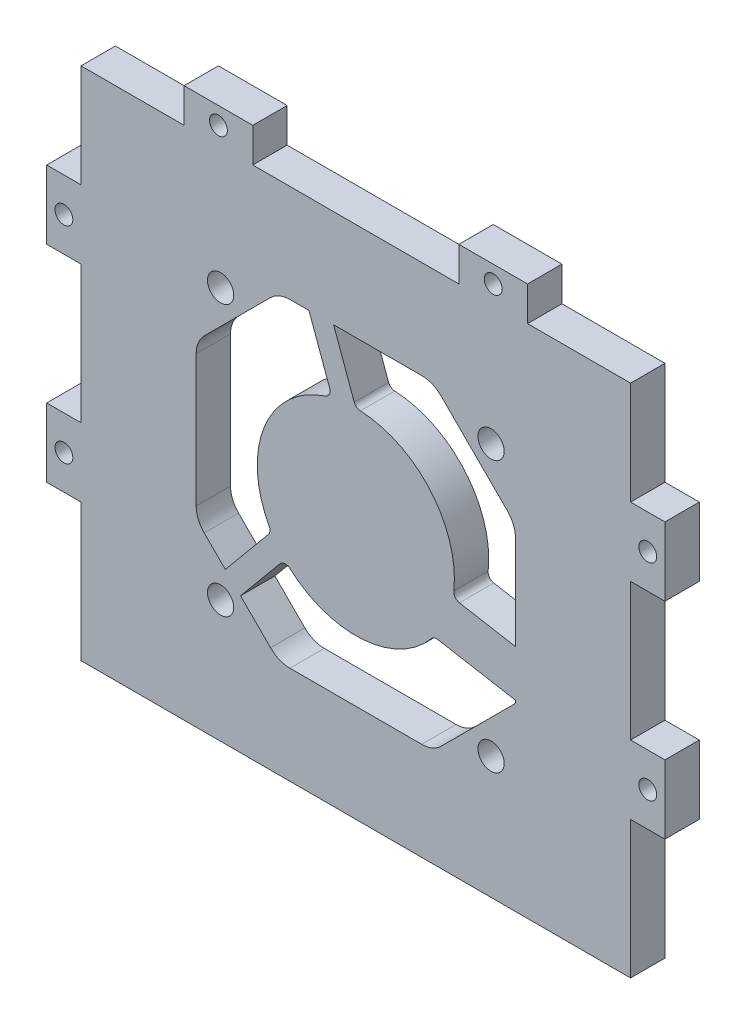
from build123d import *

# Parameters (mm, degrees)
SKETCH1_W           = 101.6
SKETCH1_H           = 95.25
BOSS_EXTRUDE1_DEPTH = 6.35
SKETCH2_W           = 12.7
SKETCH2_H           = 6.35
SKETCH2_R           = 1.651
SKETCH2_W_2         = 6.35
SKETCH2_H_2         = 12.7
BOSS_EXTRUDE2_DEPTH = 6.35
SKETCH5_R           = 2.4257
CUT_EXTRUDE1_DEPTH  = 80.746567925
FILLET1_R           = 5.08
FILLET2_R           = 1.27


with BuildPart() as part:
    # Sketch1 → Boss-Extrude1 (new body)
    with BuildSketch(Plane.XY):
        with Locations((0, -7.629593436)):
            Rectangle(SKETCH1_W, SKETCH1_H)
    extrude(amount=BOSS_EXTRUDE1_DEPTH)

    # Sketch2 → Boss-Extrude2 (add)
    # profile 1 of 6: a face of its own
    with BuildSketch(Plane.XY.offset(6.35)):
        with Locations((-25.4, 43.170406564)):
            Rectangle(SKETCH2_W, SKETCH2_H)
        with Locations((-25.4, 43.170406564)):
            Circle(SKETCH2_R, mode=Mode.SUBTRACT)
    # profile 2 of 6: a face of its own
    with BuildSketch(Plane.XY.offset(6.35)):
        with Locations((25.4, 43.170406564)):
            Rectangle(SKETCH2_W, SKETCH2_H)
        with Locations((25.4, 43.170406564)):
            Circle(SKETCH2_R, mode=Mode.SUBTRACT)
    # profile 3 of 6: a face of its own
    with BuildSketch(Plane.XY.offset(6.35)):
        with Locations((53.975, 14.595406564)):
            Rectangle(SKETCH2_W_2, SKETCH2_H_2)
        with Locations((53.975, 14.595406564)):
            Circle(SKETCH2_R, mode=Mode.SUBTRACT)
    # profile 4 of 6: a face of its own
    with BuildSketch(Plane.XY.offset(6.35)):
        with Locations((-53.975, 14.595406564)):
            Rectangle(SKETCH2_W_2, SKETCH2_H_2)
        with Locations((-53.975, 14.595406564)):
            Circle(SKETCH2_R, mode=Mode.SUBTRACT)
    # profile 5 of 6: a face of its own
    with BuildSketch(Plane.XY.offset(6.35)):
        with Locations((-53.975, -23.504593436)):
            Rectangle(SKETCH2_W_2, SKETCH2_H_2)
        with Locations((-53.975, -23.504593436)):
            Circle(SKETCH2_R, mode=Mode.SUBTRACT)
    # profile 6 of 6: a face of its own
    with BuildSketch(Plane.XY.offset(6.35)):
        with Locations((53.975, -23.504593436)):
            Rectangle(SKETCH2_W_2, SKETCH2_H_2)
        with Locations((53.975, -23.504593436)):
            Circle(SKETCH2_R, mode=Mode.SUBTRACT)
    extrude(amount=-BOSS_EXTRUDE2_DEPTH)

    # Sketch5 → Cut-Extrude1 (cut, through all)
    with BuildSketch(Plane.XY.offset(6.35)):
        with Locations((-25, 17.370406564)):
            Circle(SKETCH5_R)
        with Locations((25, 17.370406564)):
            Circle(SKETCH5_R)
        with Locations((25, -32.629593436)):
            Circle(SKETCH5_R)
        with Locations((-25, -32.629593436)):
            Circle(SKETCH5_R)
        with BuildLine():
            Line((-24.128510609, -27.305247108), (-15.606604031, -17.040561021))
            ThreePointArc((-15.606604031, -17.040561021), (-16.83342633, -0.646173195), (-4.361627061, 10.065281801))
            Line((-4.361627061, 10.065281801), (-8.664406389, 21.887070846))
            Line((-8.664406389, 21.887070846), (-14.2875, 21.887070846))
            Line((-14.2875, 21.887070846), (-29.516664282, 6.657906564))
            Line((-29.516664282, 6.657906564), (-29.516664282, -21.917093436))
            Line((-29.516664282, -21.917093436), (-24.128510609, -27.305247108))
        make_face()
        with BuildLine():
            Line((-21.317277104, -30.116480614), (-13.135965935, -20.262043681))
            ThreePointArc((-13.135965935, -20.262043681), (0.990969666, -25.827131164), (14.430051116, -18.760901761))
            Line((14.430051116, -18.760901761), (29.516664282, -21.42107871))
            Line((29.516664282, -21.42107871), (29.516664282, -21.917093436))
            Line((29.516664282, -21.917093436), (14.2875, -37.146257718))
            Line((14.2875, -37.146257718), (-14.2875, -37.146257718))
            Line((-14.2875, -37.146257718), (-21.317277104, -30.116480614))
        make_face()
        with BuildLine():
            Line((29.516664282, -12.834177729), (17.947628895, -10.79424465))
            ThreePointArc((17.947628895, -10.79424465), (13.960776954, 4.084889357), (0, 10.594906564))
            Line((0, 10.594906564), (-4.110011679, 21.887070846))
            Line((-4.110011679, 21.887070846), (14.2875, 21.887070846))
            Line((14.2875, 21.887070846), (29.516664282, 6.657906564))
            Line((29.516664282, 6.657906564), (29.516664282, -12.834177729))
        make_face()
    extrude(amount=-CUT_EXTRUDE1_DEPTH, mode=Mode.SUBTRACT)

    # Fillet1
    fillet1_edges = [part.edges().sort_by_distance(p)[0] for p in [
        (-29.516664282, 6.657906564, 3.175),
        (-14.2875, 21.887070846, 3.175),
        (-29.516664282, -21.917093436, 3.175),
        (14.2875, -37.146257718, 3.175),
        (-14.2875, -37.146257718, 3.175),
        (14.2875, 21.887070846, 3.175),
        (29.516664282, 6.657906564, 3.175),
    ]]
    fillet(fillet1_edges, radius=FILLET1_R)

    # Fillet2
    fillet2_edges = [part.edges().sort_by_distance(p)[0] for p in [
        (-4.361627061, 10.065281801, 3.175),
        (-15.606604031, -17.040561021, 3.175),
        (-13.135965935, -20.262043681, 3.175),
        (14.430051116, -18.760901761, 3.175),
        (17.947628895, -10.79424465, 3.175),
        (0, 10.594906564, 3.175),
    ]]
    fillet(fillet2_edges, radius=FILLET2_R)


solid = part.part
